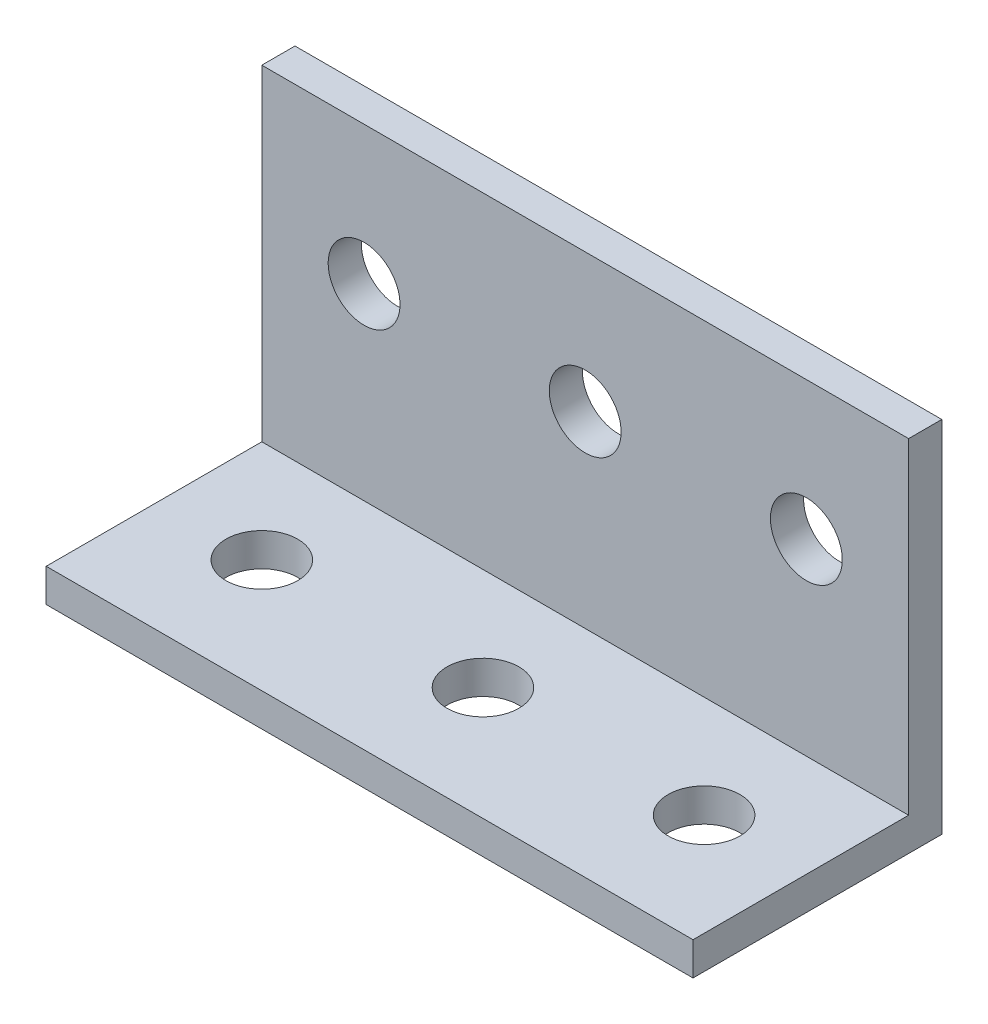
from build123d import *

# Parameters (mm, degrees)
SKETCH_1_W             = 234
SKETCH_1_H             = 130
EXTRUDE_1_DEPTH        = 90
SKETCH_2_W             = 78
SKETCH_2_H             = 118
CUT_EXTRUDE_1_DEPTH    = 283.411047943
SKETCH_3_R             = 13
CUT_EXTRUDE_2_DEPTH    = 283.411047943
PATTERN_LINEAR_1_COUNT = 3
PATTERN_LINEAR_1_PITCH = 80
SKETCH_4_R             = 13
CUT_EXTRUDE_3_DEPTH    = 283.411047943
PATTERN_LINEAR_2_COUNT = 3
PATTERN_LINEAR_2_PITCH = 80


with BuildPart() as part:
    # 草图1 → 凸台-拉伸1 (new body)
    with BuildSketch(Plane.XY):
        with Locations((117, 65)):
            Rectangle(SKETCH_1_W, SKETCH_1_H)
    extrude(amount=EXTRUDE_1_DEPTH)

    # 草图2 → 切除-拉伸1 (cut, through all)
    with BuildSketch(Plane.ZY):
        with Locations((51, 71)):
            Rectangle(SKETCH_2_W, SKETCH_2_H)
    extrude(amount=-CUT_EXTRUDE_1_DEPTH, mode=Mode.SUBTRACT)

    # 草图3 → 切除-拉伸2 (cut, through all)
    with BuildSketch(Plane(origin=(0, 0, 0), x_dir=(-1, 0, 0), z_dir=(0, 0, -1))):
        with Locations((-197, 80)):
            Circle(SKETCH_3_R)
    cut_extrude_2 = extrude(amount=-CUT_EXTRUDE_2_DEPTH, mode=Mode.SUBTRACT)

    # 阵列(线性)1: 切除-拉伸2 ×3
    with Locations(*[(-i * PATTERN_LINEAR_1_PITCH, 0, 0) for i in range(1, PATTERN_LINEAR_1_COUNT)]):
        add(cut_extrude_2, mode=Mode.SUBTRACT)

    # 草图4 → 切除-拉伸3 (cut, through all)
    with BuildSketch(Plane.XZ):
        with Locations(Location((37, 49, 0), (0, 0, 270))):
            Circle(SKETCH_4_R)
    cut_extrude_3 = extrude(amount=-CUT_EXTRUDE_3_DEPTH, mode=Mode.SUBTRACT)

    # 阵列(线性)2: 切除-拉伸3 ×3
    with Locations(*[(i * PATTERN_LINEAR_2_PITCH, 0, 0) for i in range(1, PATTERN_LINEAR_2_COUNT)]):
        add(cut_extrude_3, mode=Mode.SUBTRACT)


solid = part.part
